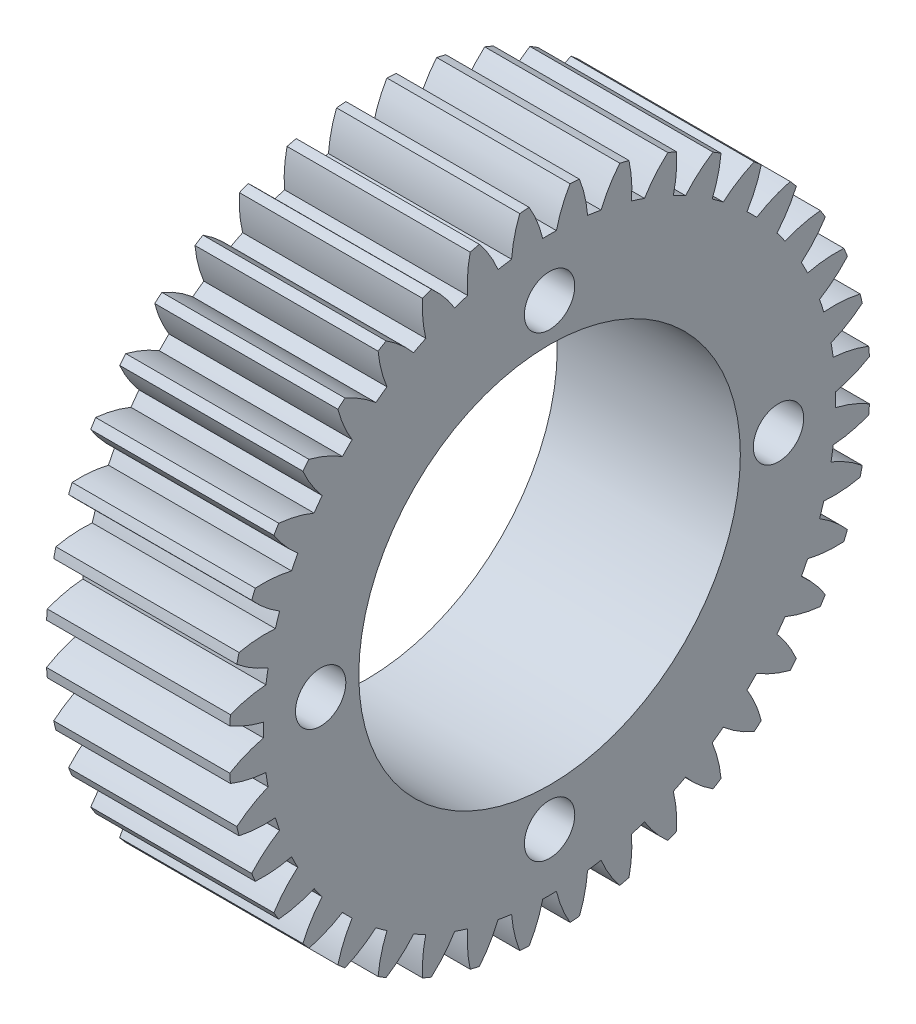
from build123d import *

# Parameters (mm, degrees)
BASPROSKE_W         = 12
BASPROSKE_H         = 21
TOOTHCUT_DEPTH      = 33.031234756
TEETHCUTS_COUNT     = 40
TEETHCUTS_ANGLE     = 351
BORSKE_R            = 12.5
BORE_DEPTH          = 50.0000508
SKETCH_1_R          = 1.65
CUT_EXTRUDE_2_DEPTH = 32.975108238


with BuildPart() as part:
    # BasProSke → Base-Revolve (revolve)
    with BuildSketch(Plane(origin=(0, 0, 0), x_dir=(1, 0, 0), z_dir=(0, 1, 0))):
        with Locations((6, 10.5)):
            Rectangle(BASPROSKE_W, BASPROSKE_H)
    revolve(axis=Axis((-10, 0, 0), (1, 0, 0)))

    # TooCutSke → ToothCut (cut, through all)
    with BuildSketch(Plane(origin=(0, 0, 0), x_dir=(0, 0, -1), z_dir=(1, 0, 0))):
        with BuildLine():
            ThreePointArc((0.448673268, 18.74363074), (0, 18.749), (-0.448673268, 18.74363074))
            ThreePointArc((-0.448673268, 18.74363074), (-0.816786816, 19.89705013), (-1.354745081, 20.981708961))
            ThreePointArc((-1.354745081, 20.981708961), (0, 21.0254), (1.354745081, 20.981708961))
            ThreePointArc((1.354745081, 20.981708961), (0.816786816, 19.89705013), (0.448673268, 18.74363074))
        make_face()
    toothcut = extrude(amount=TOOTHCUT_DEPTH, mode=Mode.SUBTRACT)

    # TeethCuts: ToothCut ×40 about axis
    teethcuts_axis = Axis((0, 0, 0), (1, 0, 0))
    for i in range(1, TEETHCUTS_COUNT):
        add(toothcut.rotate(teethcuts_axis, i * TEETHCUTS_ANGLE / (TEETHCUTS_COUNT - 1)), mode=Mode.SUBTRACT)

    # BorSke → Bore (cut, symmetric)
    with BuildSketch(Plane(origin=(0, 0, 0), x_dir=(0, 0, -1), z_dir=(1, 0, 0))):
        Circle(BORSKE_R)
    extrude(amount=BORE_DEPTH, both=True, mode=Mode.SUBTRACT)

    # 草图1 → 切除-拉伸2 (cut, through all)
    with BuildSketch(Plane(origin=(12, 0, 0), x_dir=(0, 0, -1), z_dir=(1, 0, 0))):
        with Locations((15, 0)):
            Circle(SKETCH_1_R)
        with Locations((0, 15)):
            Circle(SKETCH_1_R)
        with Locations((0, -15)):
            Circle(SKETCH_1_R)
        with Locations((-15, 0)):
            Circle(SKETCH_1_R)
    extrude(amount=-CUT_EXTRUDE_2_DEPTH, mode=Mode.SUBTRACT)


solid = part.part
